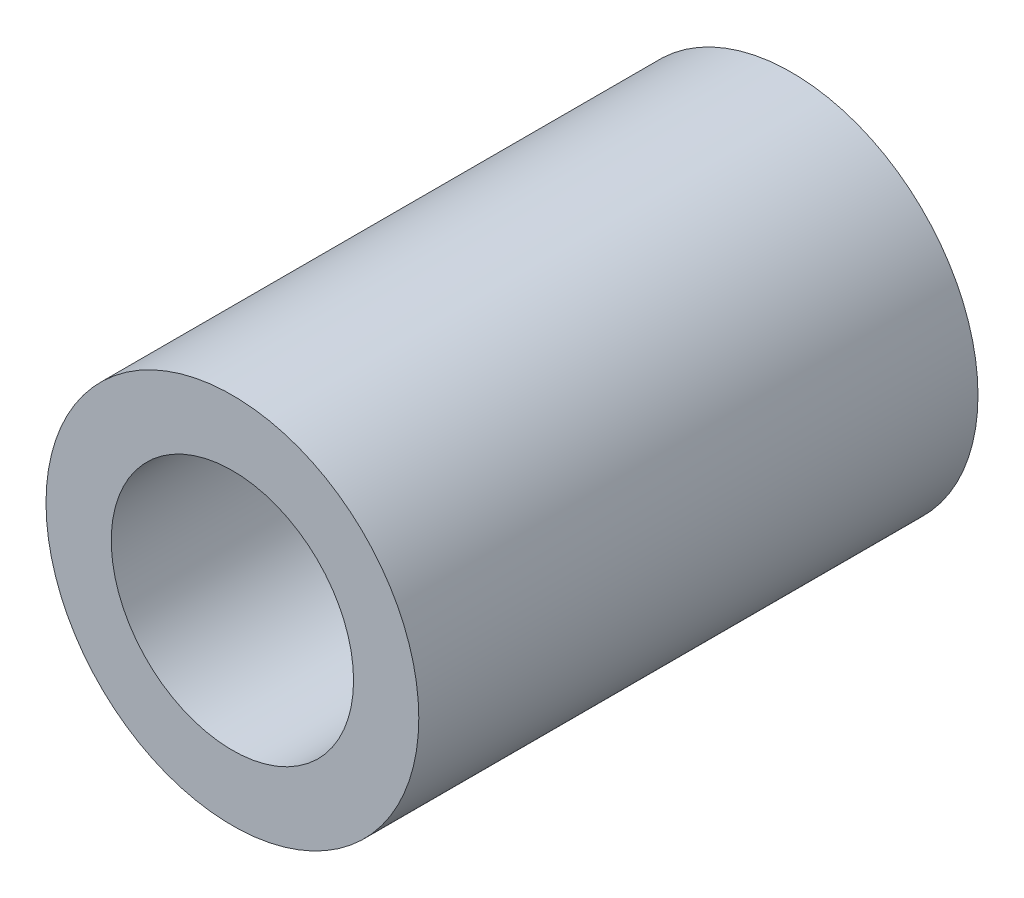
from build123d import *

# Parameters (mm, degrees)
SKETCH1_R           = 4
SKETCH1_R_2         = 2.6
BOSS_EXTRUDE1_DEPTH = 12


with BuildPart() as part:
    # Sketch1 → Boss-Extrude1 (new body)
    with BuildSketch(Plane.XY):
        Circle(SKETCH1_R)
        Circle(SKETCH1_R_2, mode=Mode.SUBTRACT)
    extrude(amount=BOSS_EXTRUDE1_DEPTH)


solid = part.part
